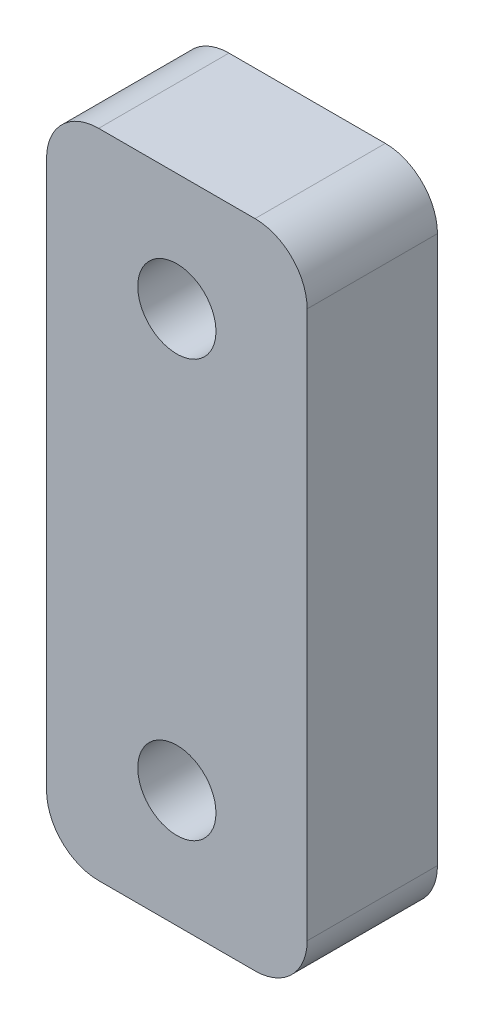
from build123d import *

# Parameters (mm, degrees)
SKETCH_2_W          = 10
SKETCH_2_H          = 25
EXTRUDE_1_DEPTH     = 5
SKETCH_3_R          = 1.5
CUT_EXTRUDE_1_DEPTH = 15.361406616
FILLET_1_R          = 2


with BuildPart() as part:
    # 草图2 → 凸台-拉伸1 (new body)
    with BuildSketch(Plane.XY):
        Rectangle(SKETCH_2_W, SKETCH_2_H)
    extrude(amount=EXTRUDE_1_DEPTH)

    # 草图3 → 切除-拉伸1 (cut, through all)
    with BuildSketch(Plane.XY.offset(5)):
        with Locations((0, -8)):
            Circle(SKETCH_3_R)
        with Locations(Location((0, 8, 0), (0, 0, 180))):
            Circle(SKETCH_3_R)
    extrude(amount=-CUT_EXTRUDE_1_DEPTH, mode=Mode.SUBTRACT)

    # 圆角1
    fillet_1_edges = [part.edges().sort_by_distance(p)[0] for p in [
        (-5, 12.5, 2.5),
        (5, 12.5, 2.5),
        (5, -12.5, 2.5),
        (-5, -12.5, 2.5),
    ]]
    fillet(fillet_1_edges, radius=FILLET_1_R)


solid = part.part
